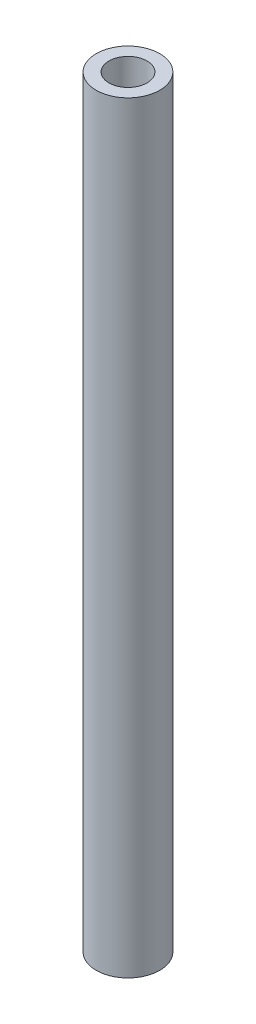
from build123d import *

# Parameters (mm, degrees)
SKETCH_1_R      = 2.5
SKETCH_1_R_2    = 1.5
EXTRUDE_1_DEPTH = 60


with BuildPart() as part:
    # 草图1 → 凸台-拉伸1 (new body)
    with BuildSketch(Plane(origin=(0, 0, 0), x_dir=(1, 0, 0), z_dir=(0, 1, 0))):
        with Locations(Location((0, 0, 0), (0, 0, 270))):
            Circle(SKETCH_1_R)
        with Locations(Location((0, 0, 0), (0, 0, 270))):
            Circle(SKETCH_1_R_2, mode=Mode.SUBTRACT)
    extrude(amount=EXTRUDE_1_DEPTH)


solid = part.part
